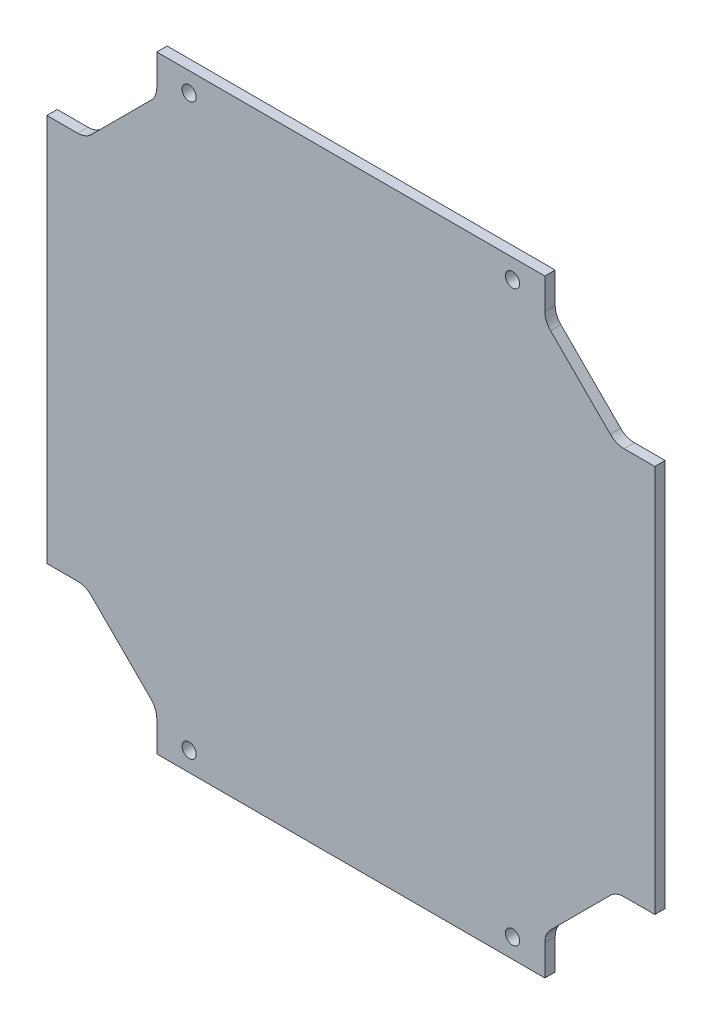
from build123d import *

# Parameters (mm, degrees)
SKETCH2_R           = 1.1
BOSS_EXTRUDE1_DEPTH = 1.6
FILLET2_R           = 3


with BuildPart() as part:
    # Sketch2 → Boss-Extrude1 (new body)
    with BuildSketch(Plane.XY):
        Polygon((-86.56534388, 74.95185693), (-86.56534388, 14.95185693), (-80.56534388, 14.95185693), (-69.56534388, 3.95185693), (-69.56534388, -2.04814307), (-9.56534388, -2.04814307), (-9.56534388, 3.95185693), (1.43465612, 14.95185693), (7.43465612, 14.95185693), (7.43465612, 74.95185693), (1.43465612, 74.95185693), (-9.56534388, 85.95185693), (-9.56534388, 91.95185693), (-69.56534388, 91.95185693), (-69.56534388, 85.95185693), (-80.56534388, 74.95185693), align=None)
        with Locations((-64.56534388, 88.95185693)):
            Circle(SKETCH2_R, mode=Mode.SUBTRACT)
        with Locations((-64.56534388, 0.95185693)):
            Circle(SKETCH2_R, mode=Mode.SUBTRACT)
        with Locations((-14.56534388, 88.95185693)):
            Circle(SKETCH2_R, mode=Mode.SUBTRACT)
        with Locations((-14.56534388, 0.95185693)):
            Circle(SKETCH2_R, mode=Mode.SUBTRACT)
    extrude(amount=BOSS_EXTRUDE1_DEPTH)

    # Fillet2
    fillet2_edges = [part.edges().sort_by_distance(p)[0] for p in [
        (-80.56534388, 74.95185693, 0.8),
        (-69.56534388, 85.95185693, 0.8),
        (-9.56534388, 85.95185693, 0.8),
        (1.43465612, 74.95185693, 0.8),
        (1.43465612, 14.95185693, 0.8),
        (-9.56534388, 3.95185693, 0.8),
        (-69.56534388, 3.95185693, 0.8),
        (-80.56534388, 14.95185693, 0.8),
    ]]
    fillet(fillet2_edges, radius=FILLET2_R)


solid = part.part
